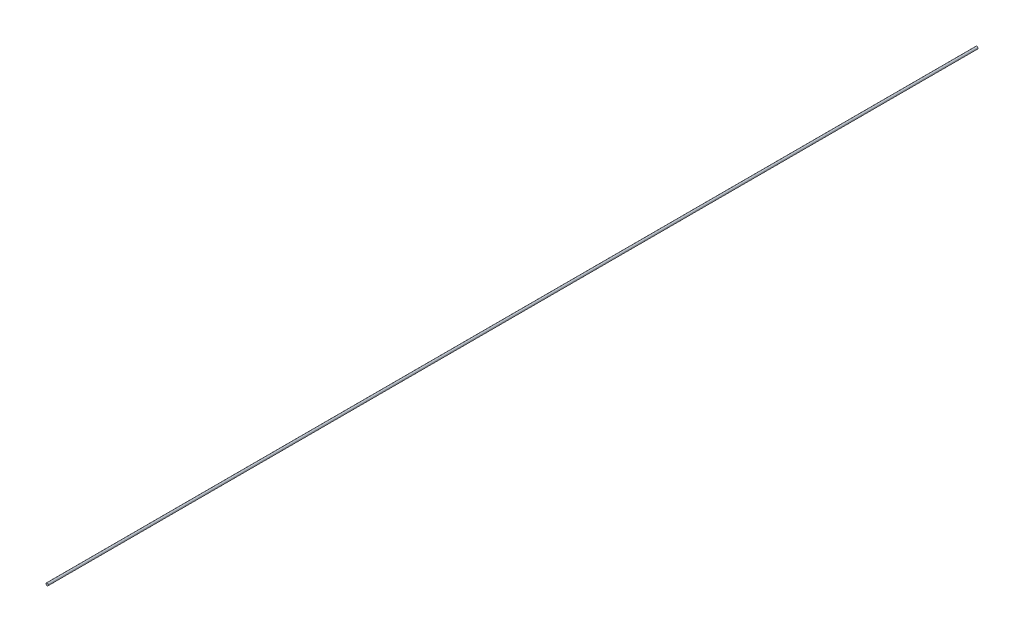
from build123d import *

# Parameters (mm, degrees)
ESQUISSE1_R        = 0.5
BOSS_EXTRU_1_DEPTH = 400


with BuildPart() as part:
    # Esquisse1 → Boss.-Extru.1 (new body)
    with BuildSketch(Plane.XY):
        Circle(ESQUISSE1_R)
    extrude(amount=BOSS_EXTRU_1_DEPTH)


solid = part.part
